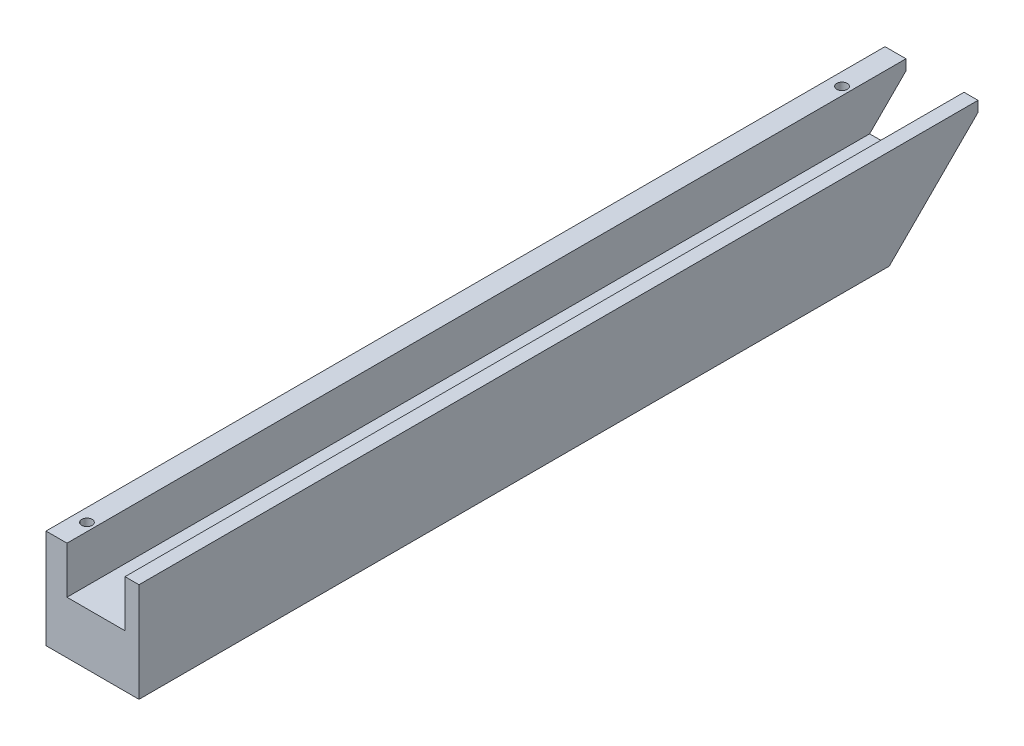
from build123d import *

# Parameters (mm, degrees)
RAIL_EXTRUDE_DEPTH = 120
SKETCH2_R          = 0.75
FIRST_HOLE_DEPTH   = 123.068100465
SKETCH3_R          = 0.75
LAST_HOLE_DEPTH    = 123.068100465
ANGLE_DEPTH        = 121.962670283


with BuildPart() as part:
    # Sketch1 → Rail-Extrude (new body)
    with BuildSketch(Plane.XY):
        Polygon((3.991071429, 6.778571429), (6.991071429, 6.778571429), (6.991071429, 0.078571429), (15.291071429, 0.078571429), (15.291071429, 6.778571429), (17.291071429, 6.778571429), (17.291071429, -7.421428571), (3.991071429, -7.421428571), align=None)
    extrude(amount=RAIL_EXTRUDE_DEPTH)

    # Sketch2 → First Hole (cut, through all)
    with BuildSketch(Plane(origin=(0, 6.778571429, 0), x_dir=(1, 0, 0), z_dir=(0, 1, 0))):
        with Locations((5.841071429, -8)):
            Circle(SKETCH2_R)
    extrude(amount=-FIRST_HOLE_DEPTH, mode=Mode.SUBTRACT)

    # Sketch3 → Last Hole (cut, through all)
    with BuildSketch(Plane(origin=(0, 6.778571429, 0), x_dir=(1, 0, 0), z_dir=(0, 1, 0))):
        with Locations((5.841071429, -116)):
            Circle(SKETCH3_R)
    extrude(amount=-LAST_HOLE_DEPTH, mode=Mode.SUBTRACT)

    # Sketch5 → Angle (cut, through all)
    with BuildSketch(Plane.ZY.offset(-3.991071429)):
        Polygon((12.7, -7.421428571), (0, 5.278571429), (0, -7.421428571), align=None)
    extrude(amount=-ANGLE_DEPTH, mode=Mode.SUBTRACT)


solid = part.part
